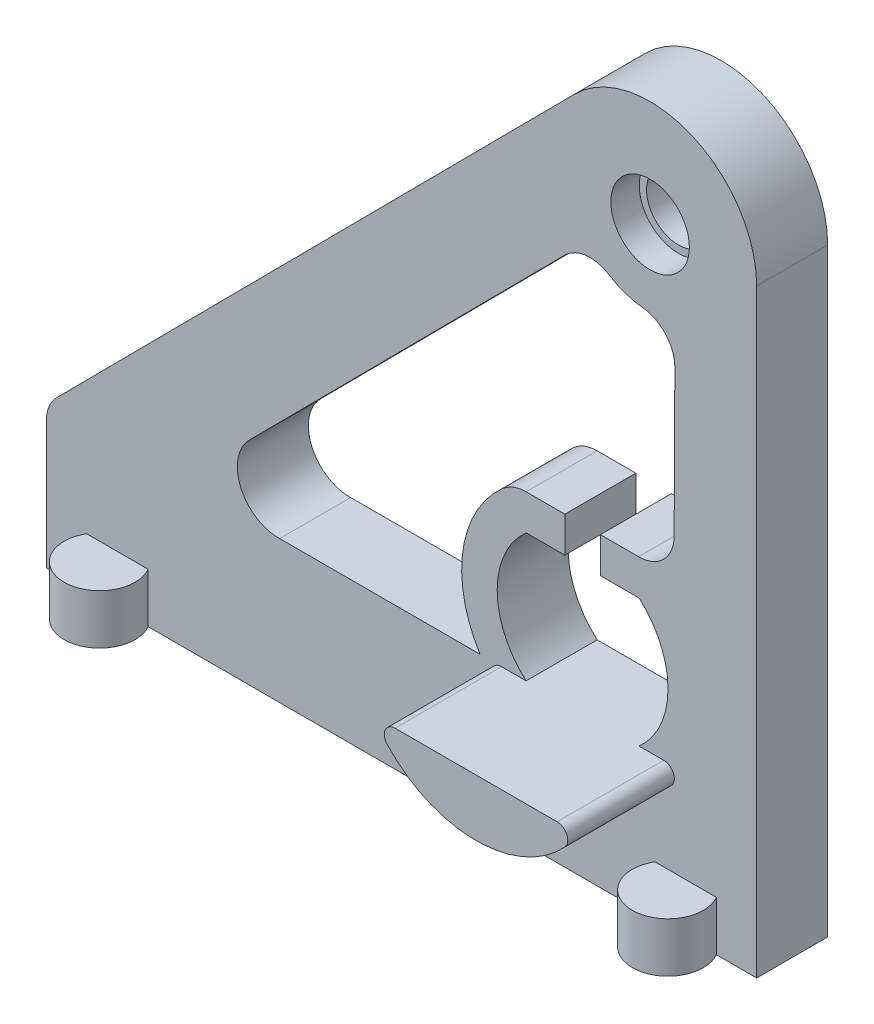
from build123d import *

# Parameters (mm, degrees)
SKETCH2_R           = 5.525
BOSS_EXTRUDE1_DEPTH = 10
SKETCH4_R           = 5
BOSS_EXTRUDE3_DEPTH = 7
SKETCH5_R           = 5.525
SKETCH5_R_2         = 4.5
BOSS_EXTRUDE4_DEPTH = 6
BOSS_EXTRUDE5_DEPTH = 15


with BuildPart() as part:
    # Sketch2 → Boss-Extrude1 (new body)
    with BuildSketch(Plane.XY):
        with BuildLine():
            Line((-88.62562975, -17.425503603), (11.37437025, -17.425503603))
            Line((11.37437025, -17.425503603), (11.37437025, 2.574496397))
            Line((11.37437025, 2.574496397), (11.37437025, 66.938471641))
            ThreePointArc((11.37437025, 66.938471641), (2.08841102, 80.807492446), (-14.272261494, 77.504891684))
            Line((-14.272261494, 77.504891684), (-87.174506998, 4.049231386))
            ThreePointArc((-87.174506998, 4.049231386), (-88.248636685, 2.431771629), (-88.62562975, 0.527091372))
            Line((-88.62562975, 0.527091372), (-88.62562975, -17.425503603))
        make_face()
        with Locations((-3.62562975, 66.938471641)):
            Circle(SKETCH2_R, mode=Mode.SUBTRACT)
        with BuildLine():
            Line((-15.629426982, 20.624496397), (-21.07612441, 20.624496397))
            ThreePointArc((-21.07612441, 20.624496397), (-25.154426982, 11.599496397), (-21.07612441, 2.574496397))
            Line((-21.07612441, 2.574496397), (-5.182729555, 2.574496397))
            ThreePointArc((-5.182729555, 2.574496397), (-1.104426982, 11.599496397), (-5.182729555, 20.624496397))
            Line((-5.182729555, 20.624496397), (-10.629426982, 20.624496397))
            Line((-10.629426982, 20.624496397), (-10.629426982, 25.624496397))
            Line((-10.629426982, 25.624496397), (-5.241089336, 25.624496397))
            ThreePointArc((-5.241089336, 25.624496397), (-1.714029472, 27.080508712), (-0.241146646, 30.600556911))
            Line((-0.241146646, 30.600556911), (-0.142030474, 51.301718396))
            ThreePointArc((-0.142030474, 51.301718396), (-1.43979486, 54.662291481), (-4.659411057, 56.278371739))
            ThreePointArc((-4.659411057, 56.278371739), (-7.11800033, 56.813760216), (-9.38382576, 57.907989239))
            ThreePointArc((-9.38382576, 57.907989239), (-12.624755601, 58.661476378), (-15.620909093, 57.214260654))
            Line((-15.620909093, 57.214260654), (-60.051592087, 12.446295905))
            ThreePointArc((-60.051592087, 12.446295905), (-61.255836785, 6.063207717), (-55.776519908, 2.574496397))
            Line((-55.776519908, 2.574496397), (-27.565492929, 2.574496397))
            ThreePointArc((-27.565492929, 2.574496397), (-29.975609484, 14.060544979), (-24.380364504, 24.37709515))
            ThreePointArc((-24.380364504, 24.37709515), (-22.842052811, 25.302262625), (-21.07612441, 25.624496397))
            Line((-21.07612441, 25.624496397), (-15.629426982, 25.624496397))
            Line((-15.629426982, 25.624496397), (-15.629426982, 20.624496397))
        make_face(mode=Mode.SUBTRACT)
    extrude(amount=BOSS_EXTRUDE1_DEPTH)

    # Sketch4 → Boss-Extrude3 (add)
    with BuildSketch(Plane.XZ.offset(17.425503603)):
        with BuildLine():
            ThreePointArc((6.37437025, 12.5), (0.080275025, 17.329629131), (-2.955756769, 10))
            Line((-2.955756769, 10), (5.704497269, 10))
            ThreePointArc((5.704497269, 10), (6.203999382, 11.205904774), (6.37437025, 12.5))
        make_face()
        with BuildLine():
            Line((5.704497269, 10), (-2.955756769, 10))
            ThreePointArc((-2.955756769, 10), (-1.125629745, 8.169872978), (1.374370261, 7.5))
            ThreePointArc((1.374370261, 7.5), (3.874370255, 8.169872984), (5.704497269, 10))
        make_face()
        with Locations((-78.62562975, 12.5)):
            Circle(SKETCH4_R)
    extrude(amount=-BOSS_EXTRUDE3_DEPTH)

    # Sketch5 → Boss-Extrude4 (add)
    with BuildSketch(Plane(origin=(0, 0, 0), x_dir=(-1, 0, 0), z_dir=(0, 0, -1))):
        with Locations((3.62562975, 66.938471641)):
            Circle(SKETCH5_R)
        with Locations((3.62562975, 66.938471641)):
            Circle(SKETCH5_R_2, mode=Mode.SUBTRACT)
    extrude(amount=-BOSS_EXTRUDE4_DEPTH)

    # Sketch6 → Boss-Extrude5 (add)
    with BuildSketch(Plane.XY.offset(10)):
        with BuildLine():
            Line((-24.542139193, 2.574496397), (-1.716714772, 2.574496397))
            ThreePointArc((-1.716714772, 2.574496397), (-0.342785676, 1.676425663), (-0.614037264, 0.057588185))
            ThreePointArc((-0.614037264, 0.057588185), (-13.129426982, -5.425503603), (-25.644816701, 0.057588185))
            ThreePointArc((-25.644816701, 0.057588185), (-25.916068288, 1.676425663), (-24.542139193, 2.574496397))
        make_face()
    extrude(amount=BOSS_EXTRUDE5_DEPTH)


solid = part.part
